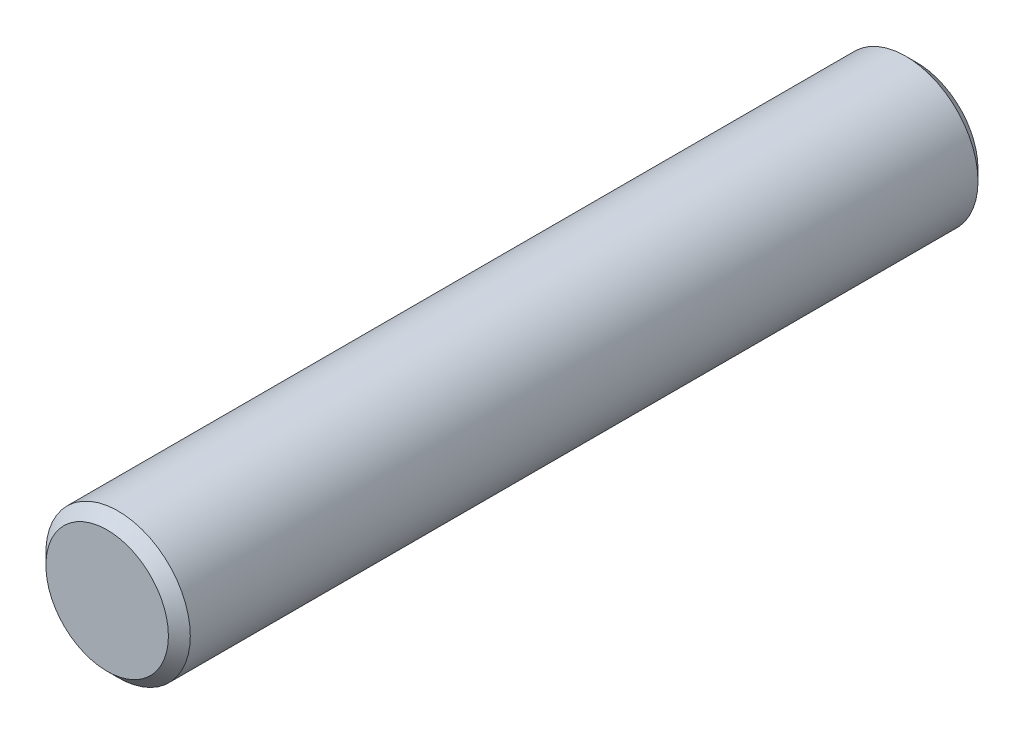
from build123d import *

# Parameters (mm, degrees)
SKETCH1_R           = 3.3
BOSS_EXTRUDE1_DEPTH = 37
CHAMFER1_SIZE       = 0.5


with BuildPart() as part:
    # Sketch1 → Boss-Extrude1 (new body)
    with BuildSketch(Plane.XY):
        Circle(SKETCH1_R)
    extrude(amount=BOSS_EXTRUDE1_DEPTH)

    # Chamfer1
    chamfer1_edges = [part.edges().sort_by_distance(p)[0] for p in [
        (-3.3, 0, 0),
        (-3.3, 0, 37),
    ]]
    chamfer(chamfer1_edges, length=CHAMFER1_SIZE)


solid = part.part
